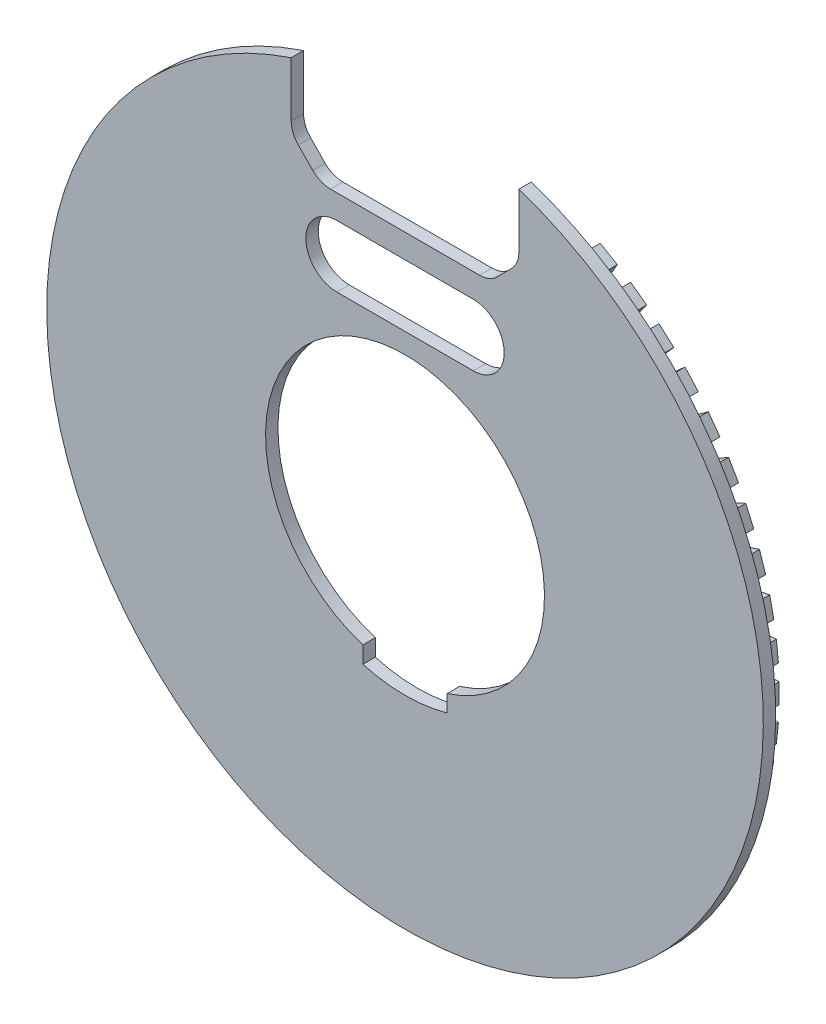
from build123d import *

# Parameters (mm, degrees)
BOSS_EXTRUDE3_DEPTH = 1
CUT_EXTRUDE1_DEPTH  = 41.883003804
BOSS_EXTRUDE4_DEPTH = 1.685
CIRPATTERN1_COUNT   = 60
CUT_EXTRUDE6_DEPTH  = 41.90549138


with BuildPart() as part:
    # Sketch3 → Boss-Extrude3 (new body)
    with BuildSketch(Plane.XY):
        with BuildLine():
            Line((-9.182572419, 22.990125112), (-9.182572425, 26.457612982))
            Line((-9.182572425, 26.457612982), (-9.182572425, 27.402378796))
            ThreePointArc((-9.182572425, 27.402378796), (-16.879479508, -23.458328405), (28.9, 0))
            ThreePointArc((28.9, 0), (23.458328405, 16.879479508), (9.182572425, 27.402378796))
            Line((9.182572425, 27.402378796), (9.182572425, 26.457612982))
            Line((9.182572425, 26.457612982), (9.18257242, 22.990106526))
            ThreePointArc((9.18257242, 22.990106526), (9.033635295, 22.232754088), (8.608969639, 21.588220098))
            Line((8.608969639, 21.588220098), (7.444379978, 20.403470535))
            ThreePointArc((7.444379978, 20.403470535), (6.791421327, 19.961095579), (6.018200802, 19.805594382))
            Line((6.018200802, 19.805594382), (-6.018220024, 19.805594382))
            ThreePointArc((-6.018220024, 19.805594382), (-6.791424338, 19.961096841), (-7.44437108, 20.403461483))
            Line((-7.44437108, 20.403461483), (-8.608960831, 21.588211138))
            ThreePointArc((-8.608960831, 21.588211138), (-9.033636435, 22.232756875), (-9.182572419, 22.990125112))
        make_face()
    extrude(amount=BOSS_EXTRUDE3_DEPTH)

    # Sketch8 → Cut-Extrude1 (cut, through all)
    with BuildSketch(Plane.XY):
        with BuildLine():
            Line((3.4, -12.080666372), (3.4, -10.723921857))
            ThreePointArc((3.4, -10.723921857), (0, 11.25), (-3.4, -10.723921857))
            Line((-3.4, -10.723921857), (-3.4, -12.080666372))
            ThreePointArc((-3.4, -12.080666372), (0, -12.55), (3.4, -12.080666372))
        make_face()
    extrude(amount=CUT_EXTRUDE1_DEPTH, mode=Mode.SUBTRACT)

    # Sketch6 → Boss-Extrude4 (add)
    with BuildSketch(Plane(origin=(0, 0, 0), x_dir=(-1, 0, 0), z_dir=(0, 0, -1))):
        Polygon((-13.057179677, 24.215698604), (-14.442820323, 23.415698604), (-12.842820323, 20.644417312), (-11.457179677, 21.444417312), align=None)
    boss_extrude4 = extrude(amount=BOSS_EXTRUDE4_DEPTH)

    # CirPattern1: Boss-Extrude4 ×60 about axis, 9 skipped
    cirpattern1_axis = Axis((0, 0, 54.6575), (0, 0, -1))
    add([boss_extrude4.rotate(cirpattern1_axis, i * 360 / CIRPATTERN1_COUNT) for i in range(1, CIRPATTERN1_COUNT) if i not in (51, 52, 53, 54, 55, 56, 57, 58, 59)])

    # Sketch12 → Cut-Extrude6 (cut, through all)
    with BuildSketch(Plane.XY):
        with BuildLine():
            Line((-5.50000746, 17.872575275), (5.49999254, 17.872575275))
            ThreePointArc((5.49999254, 17.872575275), (7.99999254, 15.372575275), (5.49999254, 12.872575275))
            Line((5.49999254, 12.872575275), (-5.50000746, 12.872575275))
            ThreePointArc((-5.50000746, 12.872575275), (-8.00000746, 15.372575275), (-5.50000746, 17.872575275))
        make_face()
    extrude(amount=CUT_EXTRUDE6_DEPTH, mode=Mode.SUBTRACT)


solid = part.part
